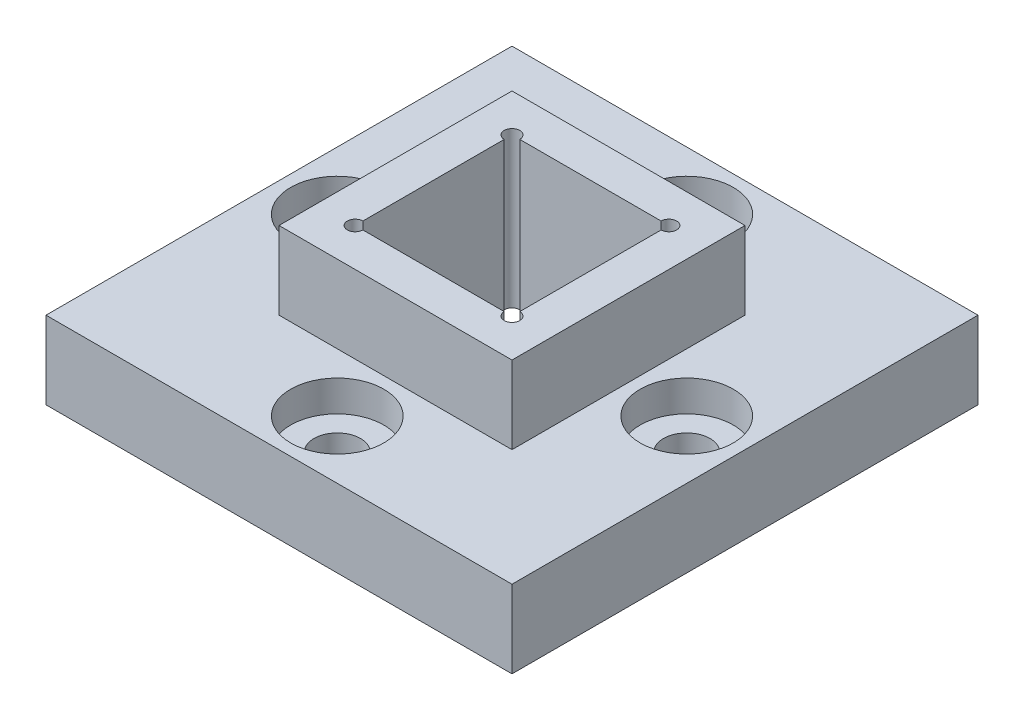
from build123d import *

# Parameters (mm, degrees)
SKETCH_1_W          = 30
SKETCH_1_H          = 30
EXTRUDE_1_DEPTH     = 5
SKETCH_2_W          = 15
SKETCH_2_H          = 15
EXTRUDE_2_DEPTH     = 5
SKETCH_3_R          = 0.5
SKETCH_3_W          = 10.1
SKETCH_3_H          = 10.1
SKETCH_3_R_2        = 1.5
CUT_EXTRUDE_1_DEPTH = 10
SKETCH_4_R          = 3
CUT_EXTRUDE_2_DEPTH = 2


with BuildPart() as part:
    # 草图1 → 凸台-拉伸1 (new body)
    with BuildSketch(Plane(origin=(0, 0, 0), x_dir=(1, 0, 0), z_dir=(0, 1, 0))):
        Rectangle(SKETCH_1_W, SKETCH_1_H)
    extrude(amount=EXTRUDE_1_DEPTH)

    # 草图2 → 凸台-拉伸2 (add)
    with BuildSketch(Plane(origin=(0, 5, 0), x_dir=(1, 0, 0), z_dir=(0, 1, 0))):
        Rectangle(SKETCH_2_W, SKETCH_2_H)
    extrude(amount=EXTRUDE_2_DEPTH)

    # 草图3 → 切除-拉伸1 (cut)
    with BuildSketch(Plane(origin=(0, 10, 0), x_dir=(1, 0, 0), z_dir=(0, 1, 0))):
        with Locations((5.05, -5.05)):
            Circle(SKETCH_3_R)
        with Locations((5.05, 5.05)):
            Circle(SKETCH_3_R)
        with Locations((-5.05, 5.05)):
            Circle(SKETCH_3_R)
        with Locations((-5.05, -5.05)):
            Circle(SKETCH_3_R)
        Rectangle(SKETCH_3_W, SKETCH_3_H)
        with BuildLine():
            ThreePointArc((5.55, 5.05), (5.05, 5.55), (4.55, 5.05))
            Line((4.55, 5.05), (5.05, 5.05))
            Line((5.05, 5.05), (5.05, 4.55))
            ThreePointArc((5.05, 4.55), (5.403553391, 4.696446609), (5.55, 5.05))
        make_face()
        with BuildLine():
            Line((5.05, 5.05), (4.55, 5.05))
            ThreePointArc((4.55, 5.05), (4.696446609, 4.696446609), (5.05, 4.55))
            Line((5.05, 4.55), (5.05, 5.05))
        make_face()
        with BuildLine():
            ThreePointArc((-4.55, -5.05), (-4.696446609, -4.696446609), (-5.05, -4.55))
            Line((-5.05, -4.55), (-5.05, -5.05))
            Line((-5.05, -5.05), (-4.55, -5.05))
        make_face()
        with BuildLine():
            Line((-5.05, -5.05), (-5.05, -4.55))
            ThreePointArc((-5.05, -4.55), (-5.403553391, -5.403553391), (-4.55, -5.05))
            Line((-4.55, -5.05), (-5.05, -5.05))
        make_face()
        with BuildLine():
            Line((-5.05, 4.55), (-5.05, 5.05))
            Line((-5.05, 5.05), (-4.55, 5.05))
            ThreePointArc((-4.55, 5.05), (-5.403553391, 5.403553391), (-5.05, 4.55))
        make_face()
        with BuildLine():
            Line((-4.55, 5.05), (-5.05, 5.05))
            Line((-5.05, 5.05), (-5.05, 4.55))
            ThreePointArc((-5.05, 4.55), (-4.696446609, 4.696446609), (-4.55, 5.05))
        make_face()
        with BuildLine():
            ThreePointArc((5.55, -5.05), (5.403553391, -4.696446609), (5.05, -4.55))
            Line((5.05, -4.55), (5.05, -5.05))
            Line((5.05, -5.05), (4.55, -5.05))
            ThreePointArc((4.55, -5.05), (5.05, -5.55), (5.55, -5.05))
        make_face()
        with BuildLine():
            Line((5.05, -5.05), (5.05, -4.55))
            ThreePointArc((5.05, -4.55), (4.696446609, -4.696446609), (4.55, -5.05))
            Line((4.55, -5.05), (5.05, -5.05))
        make_face()
        with Locations(Location((-11.25, 0, 0), (0, 0, 270))):
            Circle(SKETCH_3_R_2)
        with Locations(Location((0, 11.25, 0), (0, 0, 270))):
            Circle(SKETCH_3_R_2)
        with Locations(Location((11.25, 0, 0), (0, 0, 270))):
            Circle(SKETCH_3_R_2)
        with Locations(Location((0, -11.25, 0), (0, 0, 270))):
            Circle(SKETCH_3_R_2)
    extrude(amount=-CUT_EXTRUDE_1_DEPTH, mode=Mode.SUBTRACT)

    # 草图4 → 切除-拉伸2 (cut)
    with BuildSketch(Plane(origin=(0, 5, 0), x_dir=(1, 0, 0), z_dir=(0, 1, 0))):
        with Locations(Location((11.25, 0, 0), (0, 0, 270))):
            Circle(SKETCH_4_R)
        with Locations(Location((0, -11.25, 0), (0, 0, 270))):
            Circle(SKETCH_4_R)
        with Locations(Location((-11.25, 0, 0), (0, 0, 270))):
            Circle(SKETCH_4_R)
        with Locations(Location((0, 11.25, 0), (0, 0, 270))):
            Circle(SKETCH_4_R)
    extrude(amount=-CUT_EXTRUDE_2_DEPTH, mode=Mode.SUBTRACT)


solid = part.part
